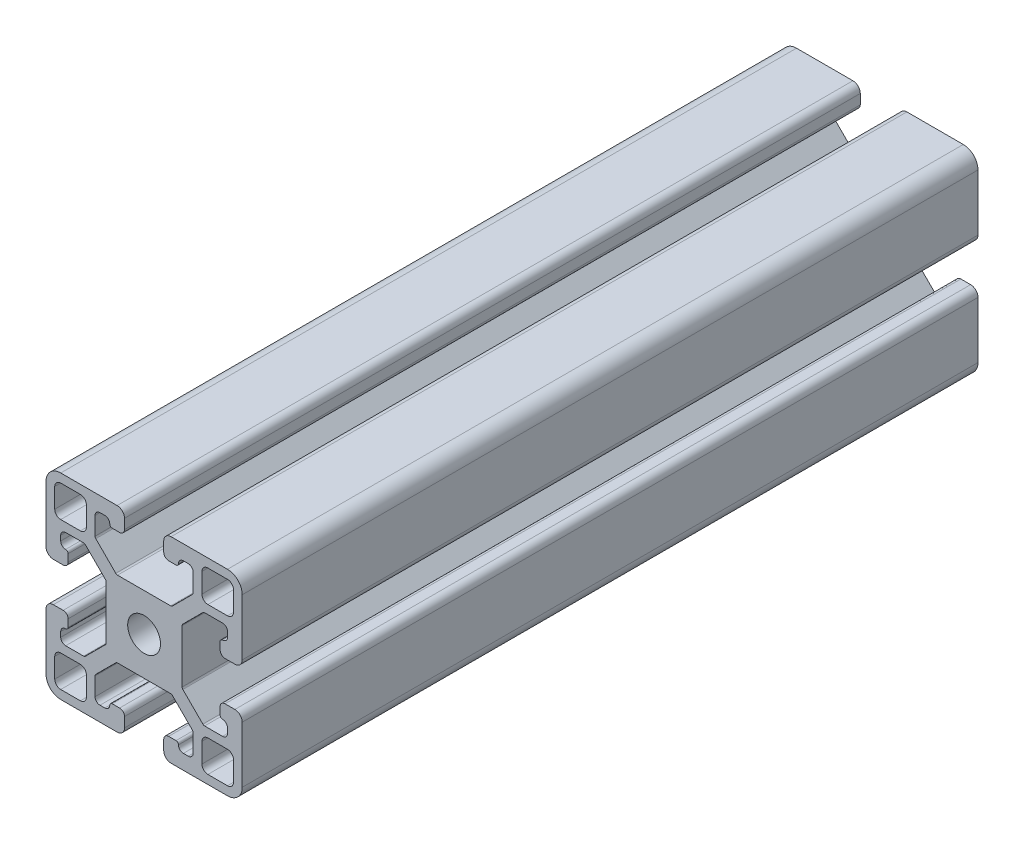
from build123d import *

# Parameters (mm, degrees)
SKETCH1_R           = 3.35
BOSS_EXTRUDE1_DEPTH = 150


with BuildPart() as part:
    # Sketch1 → Boss-Extrude1 (new body)
    with BuildSketch(Plane.XY):
        with BuildLine():
            Line((-9.853553391, -11.978553391), (-5.771446609, -7.896446609))
            ThreePointArc((-5.771446609, -7.896446609), (-5.609234935, -7.788060234), (-5.417893219, -7.75))
            Line((-5.417893219, -7.75), (5.417893219, -7.75))
            ThreePointArc((5.417893219, -7.75), (5.609234935, -7.788060234), (5.771446609, -7.896446609))
            Line((5.771446609, -7.896446609), (9.853553391, -11.978553391))
            ThreePointArc((9.853553391, -11.978553391), (9.961939766, -12.140765065), (10, -12.332106781))
            Line((10, -12.332106781), (10, -16))
            ThreePointArc((10, -16), (9.707106781, -16.707106781), (9, -17))
            Line((9, -17), (8, -17))
            ThreePointArc((8, -17), (7.292893219, -16.707106781), (7, -16))
            ThreePointArc((7, -16), (6.853553391, -15.646446609), (6.5, -15.5))
            Line((6.5, -15.5), (5, -15.5))
            ThreePointArc((5, -15.5), (4.292893219, -15.792893219), (4, -16.5))
            Line((4, -16.5), (4, -18.5))
            ThreePointArc((4, -18.5), (4.439339828, -19.560660172), (5.5, -20))
            Line((5.5, -20), (17, -20))
            ThreePointArc((17, -20), (19.121320344, -19.121320344), (20, -17))
            Line((20, -17), (20, -5.5))
            ThreePointArc((20, -5.5), (19.560660172, -4.439339828), (18.5, -4))
            Line((18.5, -4), (16.5, -4))
            ThreePointArc((16.5, -4), (15.792893219, -4.292893219), (15.5, -5))
            Line((15.5, -5), (15.5, -6.5))
            ThreePointArc((15.5, -6.5), (15.646446609, -6.853553391), (16, -7))
            ThreePointArc((16, -7), (16.707106781, -7.292893219), (17, -8))
            Line((17, -8), (17, -9))
            ThreePointArc((17, -9), (16.707106781, -9.707106781), (16, -10))
            Line((16, -10), (12.332106781, -10))
            ThreePointArc((12.332106781, -10), (12.140765065, -9.961939766), (11.978553391, -9.853553391))
            Line((11.978553391, -9.853553391), (7.896446609, -5.771446609))
            ThreePointArc((7.896446609, -5.771446609), (7.788060234, -5.609234935), (7.75, -5.417893219))
            Line((7.75, -5.417893219), (7.75, 5.417893219))
            ThreePointArc((7.75, 5.417893219), (7.788060234, 5.609234935), (7.896446609, 5.771446609))
            Line((7.896446609, 5.771446609), (11.978553391, 9.853553391))
            ThreePointArc((11.978553391, 9.853553391), (12.140765065, 9.961939766), (12.332106781, 10))
            Line((12.332106781, 10), (16, 10))
            ThreePointArc((16, 10), (16.707106781, 9.707106781), (17, 9))
            Line((17, 9), (17, 8))
            ThreePointArc((17, 8), (16.707106781, 7.292893219), (16, 7))
            ThreePointArc((16, 7), (15.646446609, 6.853553391), (15.5, 6.5))
            Line((15.5, 6.5), (15.5, 5))
            ThreePointArc((15.5, 5), (15.792893219, 4.292893219), (16.5, 4))
            Line((16.5, 4), (18.5, 4))
            ThreePointArc((18.5, 4), (19.560660172, 4.439339828), (20, 5.5))
            Line((20, 5.5), (20, 17))
            ThreePointArc((20, 17), (19.121320344, 19.121320344), (17, 20))
            Line((17, 20), (5.5, 20))
            ThreePointArc((5.5, 20), (4.439339828, 19.560660172), (4, 18.5))
            Line((4, 18.5), (4, 16.5))
            ThreePointArc((4, 16.5), (4.292893219, 15.792893219), (5, 15.5))
            Line((5, 15.5), (6.5, 15.5))
            ThreePointArc((6.5, 15.5), (6.853553391, 15.646446609), (7, 16))
            ThreePointArc((7, 16), (7.292893219, 16.707106781), (8, 17))
            Line((8, 17), (9, 17))
            ThreePointArc((9, 17), (9.707106781, 16.707106781), (10, 16))
            Line((10, 16), (10, 12.332106781))
            ThreePointArc((10, 12.332106781), (9.961939766, 12.140765065), (9.853553391, 11.978553391))
            Line((9.853553391, 11.978553391), (5.771446609, 7.896446609))
            ThreePointArc((5.771446609, 7.896446609), (5.609234935, 7.788060234), (5.417893219, 7.75))
            Line((5.417893219, 7.75), (-5.417893219, 7.75))
            ThreePointArc((-5.417893219, 7.75), (-5.609234935, 7.788060234), (-5.771446609, 7.896446609))
            Line((-5.771446609, 7.896446609), (-9.853553391, 11.978553391))
            ThreePointArc((-9.853553391, 11.978553391), (-9.961939766, 12.140765065), (-10, 12.332106781))
            Line((-10, 12.332106781), (-10, 16))
            ThreePointArc((-10, 16), (-9.707106781, 16.707106781), (-9, 17))
            Line((-9, 17), (-8, 17))
            ThreePointArc((-8, 17), (-7.292893219, 16.707106781), (-7, 16))
            ThreePointArc((-7, 16), (-6.853553391, 15.646446609), (-6.5, 15.5))
            Line((-6.5, 15.5), (-5, 15.5))
            ThreePointArc((-5, 15.5), (-4.292893219, 15.792893219), (-4, 16.5))
            Line((-4, 16.5), (-4, 18.5))
            ThreePointArc((-4, 18.5), (-4.439339828, 19.560660172), (-5.5, 20))
            Line((-5.5, 20), (-17, 20))
            ThreePointArc((-17, 20), (-19.121320344, 19.121320344), (-20, 17))
            Line((-20, 17), (-20, 5.5))
            ThreePointArc((-20, 5.5), (-19.560660172, 4.439339828), (-18.5, 4))
            Line((-18.5, 4), (-16.5, 4))
            ThreePointArc((-16.5, 4), (-15.792893219, 4.292893219), (-15.5, 5))
            Line((-15.5, 5), (-15.5, 6.5))
            ThreePointArc((-15.5, 6.5), (-15.646446609, 6.853553391), (-16, 7))
            ThreePointArc((-16, 7), (-16.707106781, 7.292893219), (-17, 8))
            Line((-17, 8), (-17, 9))
            ThreePointArc((-17, 9), (-16.707106781, 9.707106781), (-16, 10))
            Line((-16, 10), (-12.332106781, 10))
            ThreePointArc((-12.332106781, 10), (-12.140765065, 9.961939766), (-11.978553391, 9.853553391))
            Line((-11.978553391, 9.853553391), (-7.896446609, 5.771446609))
            ThreePointArc((-7.896446609, 5.771446609), (-7.788060234, 5.609234935), (-7.75, 5.417893219))
            Line((-7.75, 5.417893219), (-7.75, -5.417893219))
            ThreePointArc((-7.75, -5.417893219), (-7.788060234, -5.609234935), (-7.896446609, -5.771446609))
            Line((-7.896446609, -5.771446609), (-11.978553391, -9.853553391))
            ThreePointArc((-11.978553391, -9.853553391), (-12.140765065, -9.961939766), (-12.332106781, -10))
            Line((-12.332106781, -10), (-16, -10))
            ThreePointArc((-16, -10), (-16.707106781, -9.707106781), (-17, -9))
            Line((-17, -9), (-17, -8))
            ThreePointArc((-17, -8), (-16.707106781, -7.292893219), (-16, -7))
            ThreePointArc((-16, -7), (-15.646446609, -6.853553391), (-15.5, -6.5))
            Line((-15.5, -6.5), (-15.5, -5))
            ThreePointArc((-15.5, -5), (-15.792893219, -4.292893219), (-16.5, -4))
            Line((-16.5, -4), (-18.5, -4))
            ThreePointArc((-18.5, -4), (-19.560660172, -4.439339828), (-20, -5.5))
            Line((-20, -5.5), (-20, -17))
            ThreePointArc((-20, -17), (-19.121320344, -19.121320344), (-17, -20))
            Line((-17, -20), (-5.5, -20))
            ThreePointArc((-5.5, -20), (-4.439339828, -19.560660172), (-4, -18.5))
            Line((-4, -18.5), (-4, -16.5))
            ThreePointArc((-4, -16.5), (-4.292893219, -15.792893219), (-5, -15.5))
            Line((-5, -15.5), (-6.5, -15.5))
            ThreePointArc((-6.5, -15.5), (-6.853553391, -15.646446609), (-7, -16))
            ThreePointArc((-7, -16), (-7.292893219, -16.707106781), (-8, -17))
            Line((-8, -17), (-9, -17))
            ThreePointArc((-9, -17), (-9.707106781, -16.707106781), (-10, -16))
            Line((-10, -16), (-10, -12.332106781))
            ThreePointArc((-10, -12.332106781), (-9.961939766, -12.140765065), (-9.853553391, -11.978553391))
        make_face()
        Circle(SKETCH1_R, mode=Mode.SUBTRACT)
        with BuildLine():
            Line((-17, 11.78), (-13, 11.78))
            ThreePointArc((-13, 11.78), (-12.137329727, 12.137329727), (-11.78, 13))
            Line((-11.78, 13), (-11.78, 17))
            ThreePointArc((-11.78, 17), (-12.137329727, 17.862670273), (-13, 18.22))
            Line((-13, 18.22), (-17, 18.22))
            ThreePointArc((-17, 18.22), (-17.862670273, 17.862670273), (-18.22, 17))
            Line((-18.22, 17), (-18.22, 13))
            ThreePointArc((-18.22, 13), (-17.862670273, 12.137329727), (-17, 11.78))
        make_face(mode=Mode.SUBTRACT)
        with BuildLine():
            Line((-18.22, -13), (-18.22, -17))
            ThreePointArc((-18.22, -17), (-17.862670273, -17.862670273), (-17, -18.22))
            Line((-17, -18.22), (-13, -18.22))
            ThreePointArc((-13, -18.22), (-12.137329727, -17.862670273), (-11.78, -17))
            Line((-11.78, -17), (-11.78, -13))
            ThreePointArc((-11.78, -13), (-12.137329727, -12.137329727), (-13, -11.78))
            Line((-13, -11.78), (-17, -11.78))
            ThreePointArc((-17, -11.78), (-17.862670273, -12.137329727), (-18.22, -13))
        make_face(mode=Mode.SUBTRACT)
        with BuildLine():
            Line((13, -18.22), (17, -18.22))
            ThreePointArc((17, -18.22), (17.862670273, -17.862670273), (18.22, -17))
            Line((18.22, -17), (18.22, -13))
            ThreePointArc((18.22, -13), (17.862670273, -12.137329727), (17, -11.78))
            Line((17, -11.78), (13, -11.78))
            ThreePointArc((13, -11.78), (12.137329727, -12.137329727), (11.78, -13))
            Line((11.78, -13), (11.78, -17))
            ThreePointArc((11.78, -17), (12.137329727, -17.862670273), (13, -18.22))
        make_face(mode=Mode.SUBTRACT)
        with BuildLine():
            Line((18.22, 13), (18.22, 17))
            ThreePointArc((18.22, 17), (17.862670273, 17.862670273), (17, 18.22))
            Line((17, 18.22), (13, 18.22))
            ThreePointArc((13, 18.22), (12.137329727, 17.862670273), (11.78, 17))
            Line((11.78, 17), (11.78, 13))
            ThreePointArc((11.78, 13), (12.137329727, 12.137329727), (13, 11.78))
            Line((13, 11.78), (17, 11.78))
            ThreePointArc((17, 11.78), (17.862670273, 12.137329727), (18.22, 13))
        make_face(mode=Mode.SUBTRACT)
    extrude(amount=BOSS_EXTRUDE1_DEPTH)


solid = part.part
